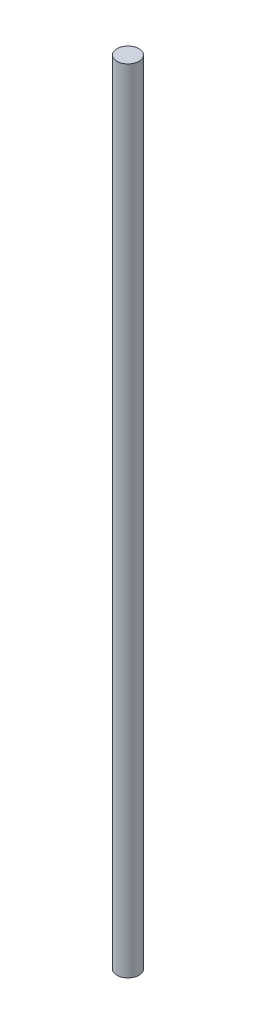
from build123d import *

# Parameters (mm, degrees)
SKETCH1_R           = 3.175
BOSS_EXTRUDE1_DEPTH = 228.6


with BuildPart() as part:
    # Sketch1 → Boss-Extrude1 (new body)
    with BuildSketch(Plane(origin=(0, 0, 0), x_dir=(1, 0, 0), z_dir=(0, 1, 0))):
        with Locations(Location((0, 0, 0), (0, 0, 270))):
            Circle(SKETCH1_R)
    extrude(amount=BOSS_EXTRUDE1_DEPTH)


solid = part.part
